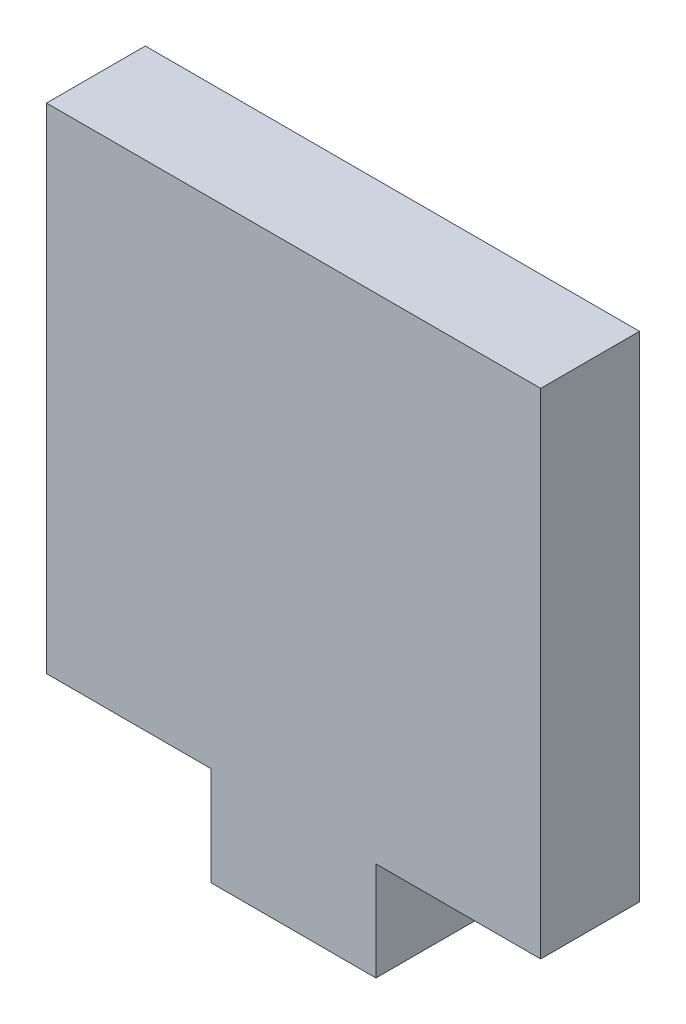
from build123d import *

# Parameters (mm, degrees)
EXTRUDE_1_DEPTH = 3


with BuildPart() as part:
    # 草图1 → 凸台-拉伸1 (new body)
    with BuildSketch(Plane.XY):
        Polygon((10, 0), (15, 0), (15, 15), (0, 15), (0, 0), (5, 0), (5, -3), (10, -3), align=None)
    extrude(amount=EXTRUDE_1_DEPTH)


solid = part.part
